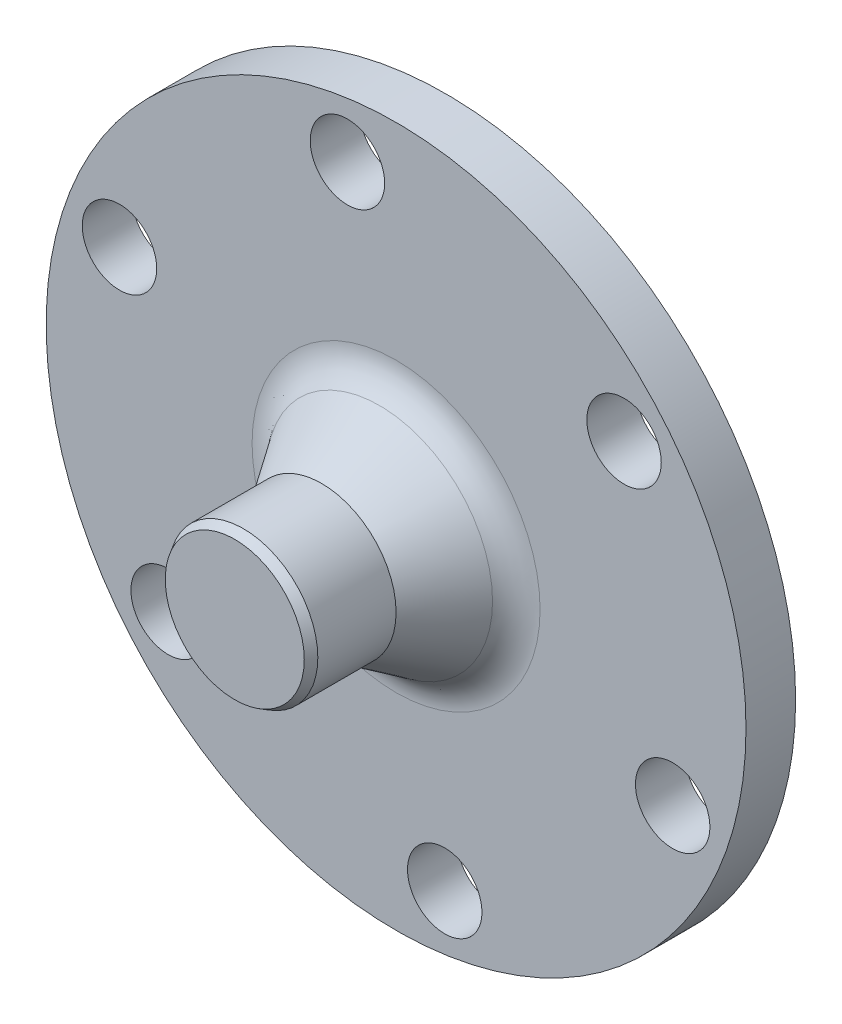
from build123d import *

# Parameters (mm, degrees)
SKETCH1_R           = 28.2
SKETCH1_R_2         = 3
BOSS_EXTRUDE1_DEPTH = 4
SKETCH1_5_R         = 6
BOSS_EXTRUDE3_DEPTH = 17
CHAMFER1_SIZE       = 6
CHAMFER1_SIZE2      = 4
FILLET3_R           = 3
CHAMFER3_SIZE       = 0.4
CHAMFER3_SIZE2      = 0.692820323


with BuildPart() as part:
    # Sketch1 → Boss-Extrude1 (new body)
    with BuildSketch(Plane.XY):
        Circle(SKETCH1_R)
        with Locations((-22.289967255, 8.342503208)):
            Circle(SKETCH1_R_2, mode=Mode.SUBTRACT)
        with Locations((-3.920163919, 23.474929496)):
            Circle(SKETCH1_R_2, mode=Mode.SUBTRACT)
        with Locations((18.369803336, 15.132426289)):
            Circle(SKETCH1_R_2, mode=Mode.SUBTRACT)
        with Locations((22.289967255, -8.342503208)):
            Circle(SKETCH1_R_2, mode=Mode.SUBTRACT)
        with Locations((3.920163919, -23.474929496)):
            Circle(SKETCH1_R_2, mode=Mode.SUBTRACT)
        with Locations((-18.369803336, -15.132426289)):
            Circle(SKETCH1_R_2, mode=Mode.SUBTRACT)
    extrude(amount=BOSS_EXTRUDE1_DEPTH)

    # Sketch1<5> → Boss-Extrude3 (add)
    with BuildSketch(Plane.XY):
        Circle(SKETCH1_5_R)
    extrude(amount=BOSS_EXTRUDE3_DEPTH)

    # Chamfer1
    chamfer1_edges = [part.edges().sort_by_distance(p)[0] for p in [
        (-6, 0, 4),
    ]]
    chamfer1_side = [part.faces().sort_by_distance(p)[0] for p in [
        (-6, 0, 10.5),
    ]]
    chamfer(chamfer1_edges, length=CHAMFER1_SIZE, length2=CHAMFER1_SIZE2, reference=chamfer1_side[0])

    # Fillet3
    fillet3_edges = [part.edges().sort_by_distance(p)[0] for p in [
        (-10, 0, 4),
    ]]
    fillet(fillet3_edges, radius=FILLET3_R)

    # Chamfer3
    chamfer3_edges = [part.edges().sort_by_distance(p)[0] for p in [
        (-6, 0, 17),
    ]]
    chamfer3_side = [part.faces().sort_by_distance(p)[0] for p in [
        (0, 0, 17),
    ]]
    chamfer(chamfer3_edges, length=CHAMFER3_SIZE, length2=CHAMFER3_SIZE2, reference=chamfer3_side[0])


solid = part.part
